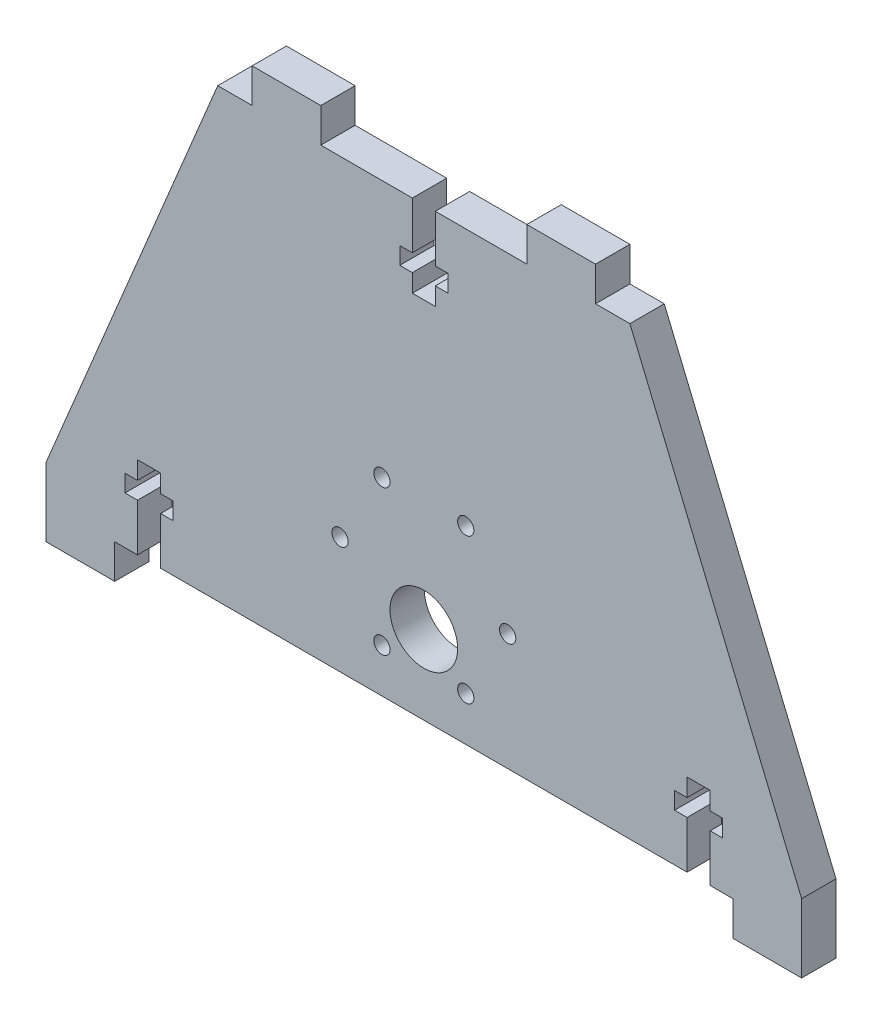
from build123d import *

# Parameters (mm, degrees)
SKETCH1_W           = 139.7
SKETCH1_H           = 82.55
BOSS_EXTRUDE1_DEPTH = 6.35
SKETCH2_W           = 12.7
SKETCH2_H           = 6.35
BOSS_EXTRUDE2_DEPTH = 6.35
CUT_EXTRUDE1_DEPTH  = 6.35
CUT_EXTRUDE8_DEPTH  = 6.35
CUT_EXTRUDE2_DEPTH  = 6.35
SKETCH5_R           = 6.254
SKETCH5_R_2         = 1.504
CUT_EXTRUDE9_DEPTH  = 6.35


with BuildPart() as part:
    # Sketch1 → Boss-Extrude1 (new body)
    with BuildSketch(Plane.XY):
        Rectangle(SKETCH1_W, SKETCH1_H)
    extrude(amount=BOSS_EXTRUDE1_DEPTH)

    # Sketch2 → Boss-Extrude2 (add)
    with BuildSketch(Plane(origin=(0, 0, 0), x_dir=(-1, 0, 0), z_dir=(0, 0, -1))):
        with Locations((-63.5, -44.45)):
            Rectangle(SKETCH2_W, SKETCH2_H)
        with Locations((-25.4, 44.45)):
            Rectangle(SKETCH2_W, SKETCH2_H)
    boss_extrude2 = extrude(amount=-BOSS_EXTRUDE2_DEPTH)

    # Sketch3 → Cut-Extrude1 (cut)
    with BuildSketch(Plane(origin=(0, 0, 0), x_dir=(-1, 0, 0), z_dir=(0, 0, -1))):
        Polygon((-52.9336, -41.275), (-52.9336, -32.512), (-55.245, -32.512), (-55.245, -29.337), (-52.9336, -29.337), (-52.9336, -26.035), (-48.6664, -26.035), (-48.6664, -29.337), (-46.355, -29.337), (-46.355, -32.512), (-48.6664, -32.512), (-48.6664, -41.275), align=None)
    cut_extrude1 = extrude(amount=-CUT_EXTRUDE1_DEPTH, mode=Mode.SUBTRACT)

    # Sketch7 → Cut-Extrude8 (cut)
    with BuildSketch(Plane(origin=(0, 0, 0), x_dir=(-1, 0, 0), z_dir=(0, 0, -1))):
        Polygon((-38.1, 41.275), (-69.85, -34.925), (-69.85, 41.275), align=None)
    cut_extrude8 = extrude(amount=-CUT_EXTRUDE8_DEPTH, mode=Mode.SUBTRACT)

    # Mirror2: Boss-Extrude2, Cut-Extrude8 across plane
    add(boss_extrude2.mirror(Plane(origin=(0, 0, 0), x_dir=(0, 0, 1), z_dir=(1, 0, 0))))
    add(cut_extrude8.mirror(Plane(origin=(0, 0, 0), x_dir=(0, 0, 1), z_dir=(1, 0, 0))), mode=Mode.SUBTRACT)

    # Mirror4: Cut-Extrude1 across plane
    add(cut_extrude1.mirror(Plane(origin=(0, 0, 0), x_dir=(0, 0, 1), z_dir=(1, 0, 0))), mode=Mode.SUBTRACT)

    # Sketch4 → Cut-Extrude2 (cut)
    with BuildSketch(Plane(origin=(0, 0, 0), x_dir=(-1, 0, 0), z_dir=(0, 0, -1))):
        Polygon((2.1209, 41.275), (-2.1209, 41.275), (-2.1209, 32.512), (-4.445, 32.512), (-4.445, 29.337), (-2.1209, 29.337), (-2.1209, 26.035), (2.1209, 26.035), (2.1209, 29.337), (4.445, 29.337), (4.445, 32.512), (2.1209, 32.512), align=None)
    extrude(amount=-CUT_EXTRUDE2_DEPTH, mode=Mode.SUBTRACT)

    # Sketch5 → Cut-Extrude9 (cut)
    with BuildSketch(Plane(origin=(0, 0, 0), x_dir=(-1, 0, 0), z_dir=(0, 0, -1))):
        with Locations((0, -26.7)):
            Circle(SKETCH5_R)
        with Locations((-15.5, -19.7)):
            Circle(SKETCH5_R_2)
        with Locations((-7.75, -6.276606241)):
            Circle(SKETCH5_R_2)
        with Locations((7.75, -6.276606241)):
            Circle(SKETCH5_R_2)
        with Locations((15.5, -19.7)):
            Circle(SKETCH5_R_2)
        with Locations((7.75, -33.123393759)):
            Circle(SKETCH5_R_2)
        with Locations((-7.75, -33.123393759)):
            Circle(SKETCH5_R_2)
    extrude(amount=-CUT_EXTRUDE9_DEPTH, mode=Mode.SUBTRACT)


solid = part.part
